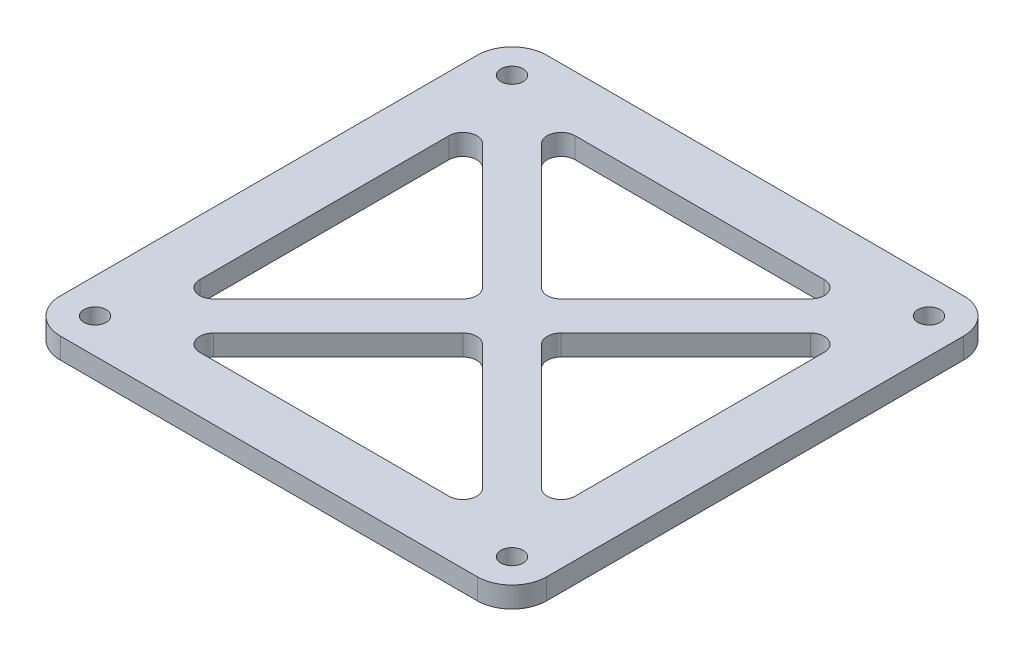
from build123d import *

# Parameters (mm, degrees)
SKETCH_1_W                       = 70
SKETCH_1_H                       = 70
SKETCH_1_R                       = 1.6
EXTRUDE_1_DEPTH                  = 3
FILLET_1_R                       = 5
CUT_EXTRUDE_2_DEPTH              = 50.588305073
FILLET_2_R                       = 2
PATTERN_CIRCULAR_1_COUNT         = 4
FILLET_2_OF_PATTERN_CIRCULAR_1_R = 2


with BuildPart() as part:
    # 草图1 → 凸台-拉伸1 (new body)
    with BuildSketch(Plane(origin=(0, 0, 0), x_dir=(1, 0, 0), z_dir=(0, 1, 0))):
        Rectangle(SKETCH_1_W, SKETCH_1_H)
        with Locations(Location((-30, 30, 0), (0, 0, 270))):
            Circle(SKETCH_1_R, mode=Mode.SUBTRACT)
        with Locations(Location((30, 30, 0), (0, 0, 270))):
            Circle(SKETCH_1_R, mode=Mode.SUBTRACT)
        with Locations(Location((30, -30, 0), (0, 0, 270))):
            Circle(SKETCH_1_R, mode=Mode.SUBTRACT)
        with Locations(Location((-30, -30, 0), (0, 0, 270))):
            Circle(SKETCH_1_R, mode=Mode.SUBTRACT)
    extrude(amount=EXTRUDE_1_DEPTH)

    # 圆角1
    fillet_1_edges = [part.edges().sort_by_distance(p)[0] for p in [
        (-35, 1.5, -35),
        (35, 1.5, -35),
        (35, 1.5, 35),
        (-35, 1.5, 35),
    ]]
    fillet(fillet_1_edges, radius=FILLET_1_R)

    # 草图2 → 切除-拉伸2 (cut, through all)
    with BuildSketch(Plane(origin=(0, 3, 0), x_dir=(1, 0, 0), z_dir=(0, 1, 0))):
        Polygon((-22.757359313, 27), (0, 4.242640687), (22.757359313, 27), align=None)
    cut_extrude_2 = extrude(amount=-CUT_EXTRUDE_2_DEPTH, mode=Mode.SUBTRACT)

    # 圆角2
    fillet_2_edges = [part.edges().sort_by_distance(p)[0] for p in [
        (22.757359313, 1.5, -27),
        (0, 1.5, -4.242640687),
        (-22.757359313, 1.5, -27),
    ]]
    fillet(fillet_2_edges, radius=FILLET_2_R)

    # 阵列(圆周)1: 切除-拉伸2 ×4 about axis
    pattern_circular_1_axis = Axis((0, 0, 0), (0, 1, 0))
    for i in range(1, PATTERN_CIRCULAR_1_COUNT):
        add(cut_extrude_2.rotate(pattern_circular_1_axis, i * 360 / PATTERN_CIRCULAR_1_COUNT), mode=Mode.SUBTRACT)

    # 圆角2 of 阵列(圆周)1
    fillet_2_of_pattern_circular_1_edges = [part.edges().sort_by_distance(p)[0] for p in [
        (-27, 1.5, -22.757359313),
        (-4.242640687, 1.5, 0),
        (-27, 1.5, 22.757359313),
        (-22.757359313, 1.5, 27),
        (0, 1.5, 4.242640687),
        (22.757359313, 1.5, 27),
        (27, 1.5, 22.757359313),
        (4.242640687, 1.5, 0),
        (27, 1.5, -22.757359313),
    ]]
    fillet(fillet_2_of_pattern_circular_1_edges, radius=FILLET_2_OF_PATTERN_CIRCULAR_1_R)


solid = part.part
